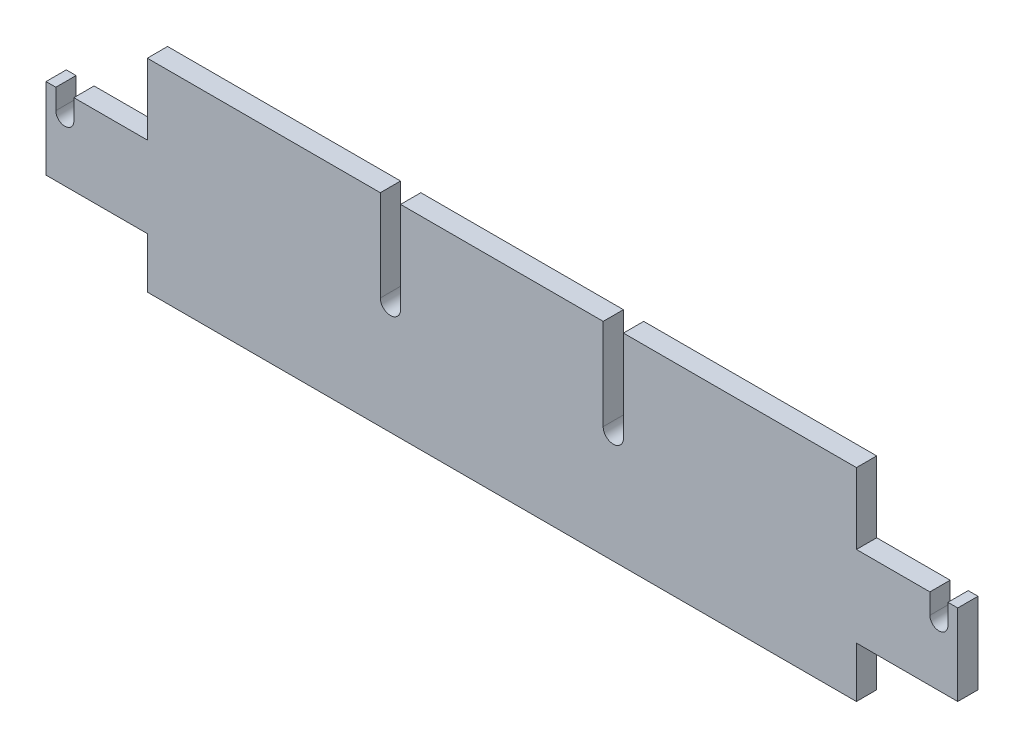
from build123d import *

# Parameters (mm, degrees)
RESSALTO_EXTRUS_O1_DEPTH = 2


with BuildPart() as part:
    # Esboço1 → Ressalto-extrusão1 (new body)
    with BuildSketch(Plane.XY):
        with BuildLine():
            Line((-35, 0), (0, 0))
            Line((0, 0), (35, 0))
            Line((35, 0), (35, 5))
            Line((35, 5), (45, 5))
            Line((45, 5), (45, 13))
            Line((45, 13), (44.031459095, 13))
            Line((44.031459095, 13), (44.031459095, 11))
            ThreePointArc((44.031459095, 11), (43.141182377, 10.109723283), (42.25090566, 11))
            Line((42.25090566, 11), (42.25090566, 13))
            Line((42.25090566, 13), (35, 13))
            Line((35, 13), (35, 20))
            Line((35, 20), (12, 20))
            Line((12, 20), (12, 11))
            ThreePointArc((12, 11), (11, 10), (10, 11))
            Line((10, 11), (10, 20))
            Line((10, 20), (-10, 20))
            Line((-10, 20), (-10, 11))
            ThreePointArc((-10, 11), (-11, 10), (-12, 11))
            Line((-12, 11), (-12, 20))
            Line((-12, 20), (-35, 20))
            Line((-35, 20), (-35, 13))
            Line((-35, 13), (-42.25090566, 13))
            Line((-42.25090566, 13), (-42.25090566, 11))
            ThreePointArc((-42.25090566, 11), (-43.141182377, 10.109723283), (-44.031459095, 11))
            Line((-44.031459095, 11), (-44.031459095, 13))
            Line((-44.031459095, 13), (-45, 13))
            Line((-45, 13), (-45, 5))
            Line((-45, 5), (-35, 5))
            Line((-35, 5), (-35, 0))
        make_face()
    extrude(amount=RESSALTO_EXTRUS_O1_DEPTH)


solid = part.part
